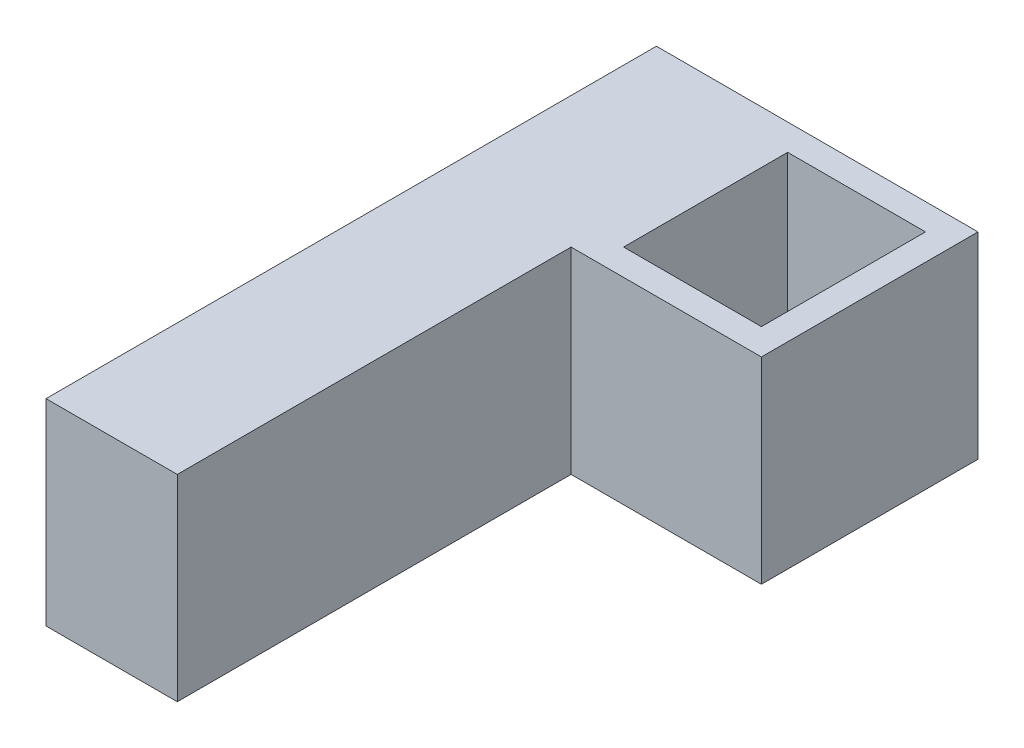
from build123d import *

# Parameters (mm, degrees)
SKETCH2_W           = 10.5
SKETCH2_H           = 12.5
BOSS_EXTRUDE1_DEPTH = 15


with BuildPart() as part:
    # Sketch2 → Boss-Extrude1 (new body)
    with BuildSketch(Plane(origin=(0, 0, 0), x_dir=(1, 0, 0), z_dir=(0, 1, 0))):
        Polygon((-2, -14.5), (12.5, -14.5), (12.5, 2), (-2, 2), (-12, 2), (-12, -14.5), (-12, -44.5), (-2, -44.5), align=None)
        with Locations((5.25, -6.25)):
            Rectangle(SKETCH2_W, SKETCH2_H, mode=Mode.SUBTRACT)
    extrude(amount=BOSS_EXTRUDE1_DEPTH)


solid = part.part
